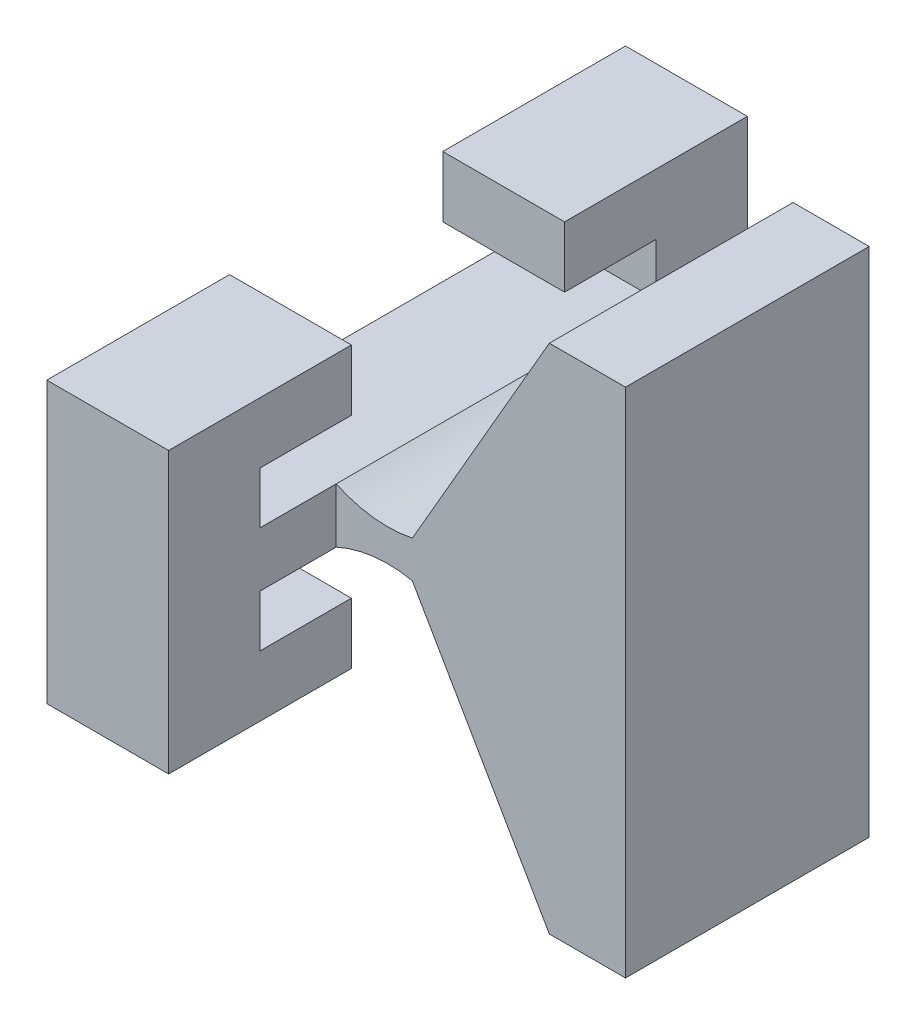
from build123d import *

# Parameters (mm, degrees)
EXTRUDE_1_DEPTH          = 4
SKETCH_3_W               = 4
SKETCH_3_H               = 1.8
EXTRUDE_2_DEPTH          = 5.5
SKETCH_5_W               = 4
SKETCH_5_H               = 3
EXTRUDE_3_DEPTH          = 3.7
MIRROR_3_COPY_1_SKETCH_W = 4
MIRROR_3_COPY_1_SKETCH_H = 3
MIRROR_3_COPY_1_DEPTH    = 3.7
SKETCH_7_W               = 4
SKETCH_7_H               = 2
EXTRUDE_4_DEPTH          = 3
MIRROR_5_COPY_1_SKETCH_W = 4
MIRROR_5_COPY_1_SKETCH_H = 2
MIRROR_5_COPY_1_DEPTH    = 3


with BuildPart() as part:
    # Эскиз2 → Бобышка-Вытянуть1 (new, symmetric)
    with BuildSketch(Plane.XY):
        with BuildLine():
            Line((0, 0), (0, 0.9))
            Line((0, 0.9), (4, 0.9))
            ThreePointArc((4, 0.9), (5.226251594, 0.551100379), (6.5, 0.605771366))
            Line((6.5, 0.605771366), (11, 8.4))
            Line((11, 8.4), (13.5, 8.4))
            Line((13.5, 8.4), (13.5, -8.4))
            Line((13.5, -8.4), (11, -8.4))
            Line((11, -8.4), (6.5, -0.605771366))
            ThreePointArc((6.5, -0.605771366), (5.226251594, -0.551100379), (4, -0.9))
            Line((4, -0.9), (0, -0.9))
            Line((0, -0.9), (0, 0))
        make_face()
    extrude(amount=EXTRUDE_1_DEPTH, both=True)

    # Эскиз3 → Бобышка-Вытянуть2 (add)
    with BuildSketch(Plane(origin=(0, 0, -4), x_dir=(-1, 0, 0), z_dir=(0, 0, -1))):
        with Locations((-2, 0)):
            Rectangle(SKETCH_3_W, SKETCH_3_H)
    extrude_2 = extrude(amount=EXTRUDE_2_DEPTH)

    # Зеркальное отражение1: Бобышка-Вытянуть2 across plane
    add(extrude_2.mirror(Plane.XY))

    # Эскиз5 → Бобышка-Вытянуть3 (add)
    with BuildSketch(Plane(origin=(0, 0.9, 0), x_dir=(1, 0, 0), z_dir=(0, 1, 0))):
        with Locations((2, 8)):
            Rectangle(SKETCH_5_W, SKETCH_5_H)
    extrude_3 = extrude(amount=EXTRUDE_3_DEPTH)

    # Зеркальное отражение2: Бобышка-Вытянуть3 across plane
    add(extrude_3.mirror(Plane.XY))

    # Зеркальное отражение3: Бобышка-Вытянуть3 across plane
    add(extrude_3.mirror(Plane.ZX))

    # Зеркальное отражение3 copy 1 sketch → Зеркальное отражение3 copy 1 (add)
    with BuildSketch(Plane.XZ.offset(0.9)):
        with Locations((2, 8)):
            Rectangle(MIRROR_3_COPY_1_SKETCH_W, MIRROR_3_COPY_1_SKETCH_H)
    extrude(amount=MIRROR_3_COPY_1_DEPTH)

    # Эскиз7 → Бобышка-Вытянуть4 (add)
    with BuildSketch(Plane(origin=(0, 0, 6.5), x_dir=(-1, 0, 0), z_dir=(0, 0, -1))):
        with Locations((-2, 3.6)):
            Rectangle(SKETCH_7_W, SKETCH_7_H)
    extrude_4 = extrude(amount=EXTRUDE_4_DEPTH)

    # Зеркальное отражение4: Бобышка-Вытянуть4 across plane
    add(extrude_4.mirror(Plane.XY))

    # Зеркальное отражение5: Бобышка-Вытянуть4 across plane
    add(extrude_4.mirror(Plane.ZX))

    # Зеркальное отражение5 copy 1 sketch → Зеркальное отражение5 copy 1 (add)
    with BuildSketch(Plane(origin=(0, 0, -6.5), x_dir=(-1, 0, 0), z_dir=(0, 0, 1))):
        with Locations((-2, 3.6)):
            Rectangle(MIRROR_5_COPY_1_SKETCH_W, MIRROR_5_COPY_1_SKETCH_H)
    extrude(amount=MIRROR_5_COPY_1_DEPTH)


solid = part.part
